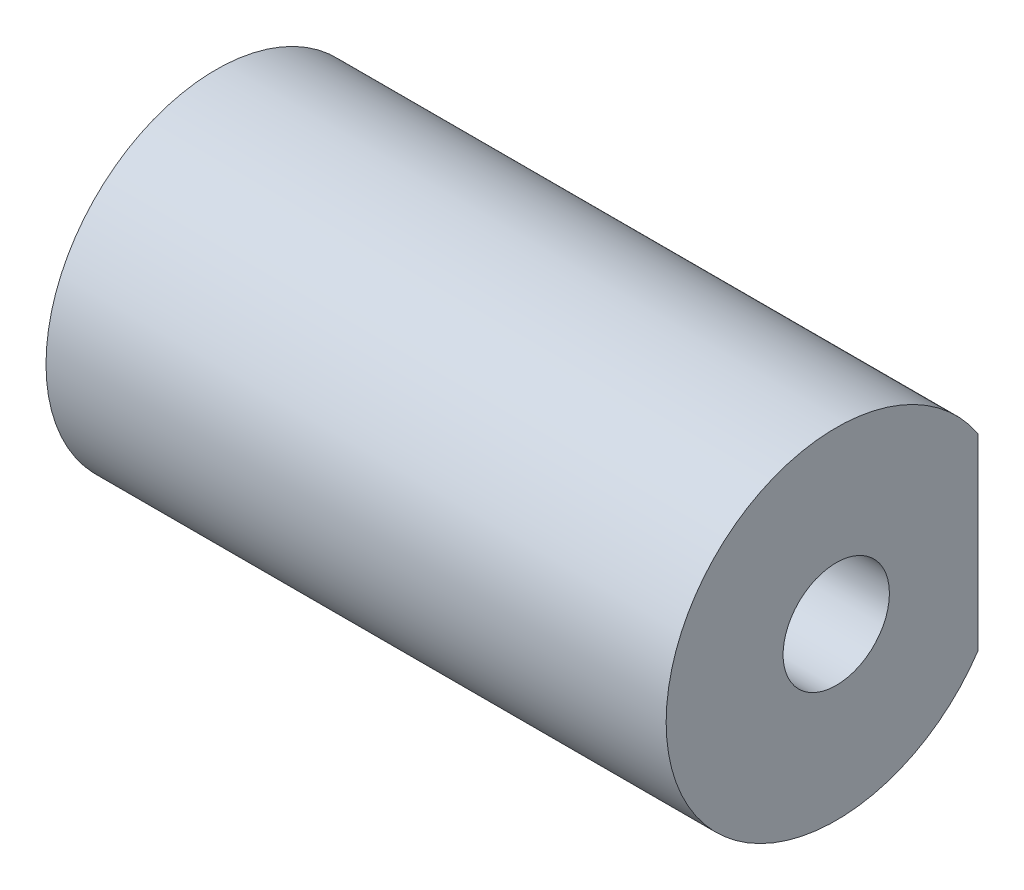
from build123d import *

# Parameters (mm, degrees)
SKETCH1_R           = 4.8
SKETCH1_R_2         = 1.5
BOSS_EXTRUDE1_DEPTH = 17.5
SKETCH2_W           = 8.41396409
SKETCH2_H           = 14.524915231
CUT_EXTRUDE1_DEPTH  = 19.770455509


with BuildPart() as part:
    # Sketch1 → Boss-Extrude1 (new body)
    with BuildSketch(Plane(origin=(0, 0, 0), x_dir=(0, 0, -1), z_dir=(1, 0, 0))):
        Circle(SKETCH1_R)
        Circle(SKETCH1_R_2, mode=Mode.SUBTRACT)
    extrude(amount=BOSS_EXTRUDE1_DEPTH)

    # Sketch2 → Cut-Extrude1 (cut, through all)
    with BuildSketch(Plane(origin=(17.5, 0, 0), x_dir=(0, 0, -1), z_dir=(1, 0, 0))):
        with Locations((8.206982045, -0.088400346)):
            Rectangle(SKETCH2_W, SKETCH2_H)
    extrude(amount=-CUT_EXTRUDE1_DEPTH, mode=Mode.SUBTRACT)


solid = part.part
